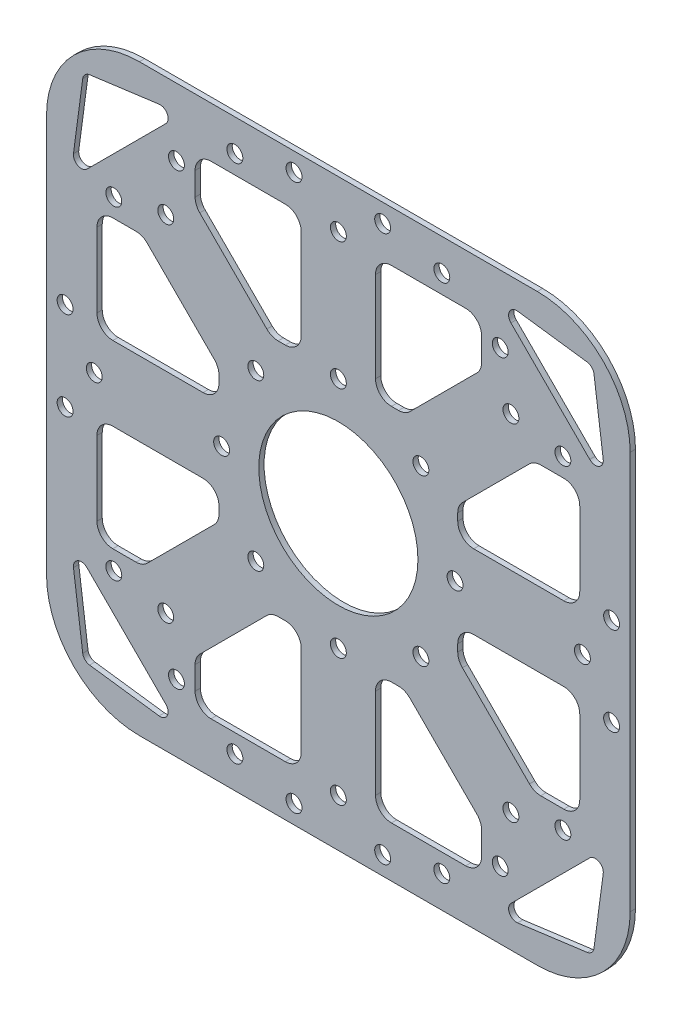
from build123d import *

# Parameters (mm, degrees)
SALIENTE_EXTRUIR1_DEPTH = 1
CROQUIS3_R              = 1.5
CROQUIS3_R_2            = 15
CORTAR_EXTRUIR1_DEPTH   = 1
CORTAR_EXTRUIR2_DEPTH   = 1
CROQUIS5_R              = 1.5
CORTAR_EXTRUIR3_DEPTH   = 1
CORTAR_EXTRUIR4_DEPTH   = 1
CROQUIS8_R              = 1.5
CORTAR_EXTRUIR5_DEPTH   = 1


with BuildPart() as part:
    # Croquis1 → Saliente-Extruir1 (new body)
    with BuildSketch(Plane.XY):
        with BuildLine():
            Line((17.5, 0), (92.5, 0))
            ThreePointArc((92.5, 0), (104.874368671, 5.125631329), (110, 17.5))
            Line((110, 17.5), (110, 92.5))
            ThreePointArc((110, 92.5), (104.874368671, 104.874368671), (92.5, 110))
            Line((92.5, 110), (17.5, 110))
            ThreePointArc((17.5, 110), (5.125631329, 104.874368671), (0, 92.5))
            Line((0, 92.5), (0, 17.5))
            ThreePointArc((0, 17.5), (5.125631329, 5.125631329), (17.5, 0))
        make_face()
    extrude(amount=-SALIENTE_EXTRUIR1_DEPTH)

    # Croquis3 → Cortar-Extruir1 (cut)
    with BuildSketch(Plane.XY):
        with Locations((77, 55)):
            Circle(CROQUIS3_R)
        with Locations((55, 55)):
            Circle(CROQUIS3_R_2)
        with Locations((70.556349186, 70.556349186)):
            Circle(CROQUIS3_R)
        with Locations((87.526911935, 87.526911935)):
            Circle(CROQUIS3_R)
        with Locations((101, 55)):
            Circle(CROQUIS3_R)
        with Locations((70.556349186, 39.443650814)):
            Circle(CROQUIS3_R)
        with Locations((87.526911935, 22.473088065)):
            Circle(CROQUIS3_R)
        with Locations((55, 33)):
            Circle(CROQUIS3_R)
        with Locations((55, 9)):
            Circle(CROQUIS3_R)
        with Locations((39.443650814, 39.443650814)):
            Circle(CROQUIS3_R)
        with Locations((22.473088065, 22.473088065)):
            Circle(CROQUIS3_R)
        with Locations((33, 55)):
            Circle(CROQUIS3_R)
        with Locations((9, 55)):
            Circle(CROQUIS3_R)
        with Locations((39.443650814, 70.556349186)):
            Circle(CROQUIS3_R)
        with Locations((22.473088065, 87.526911935)):
            Circle(CROQUIS3_R)
        with Locations((55, 77)):
            Circle(CROQUIS3_R)
        with Locations((55, 101)):
            Circle(CROQUIS3_R)
    extrude(amount=-CORTAR_EXTRUIR1_DEPTH, mode=Mode.SUBTRACT)

    # Croquis4 → Cortar-Extruir2 (cut)
    with BuildSketch(Plane.XY):
        with BuildLine():
            Line((62, 97.5), (62, 80.5))
            ThreePointArc((62, 80.5), (62.878679656, 78.378679656), (65, 77.5))
            Line((65, 77.5), (66.357864376, 77.5))
            ThreePointArc((66.357864376, 77.5), (67.505914673, 77.728361402), (68.47918472, 78.378679656))
            Line((68.47918472, 78.378679656), (81.121320344, 91.02081528))
            ThreePointArc((81.121320344, 91.02081528), (81.771638598, 91.994085327), (82, 93.142135624))
            Line((82, 93.142135624), (82, 97.5))
            ThreePointArc((82, 97.5), (81.121320344, 99.621320344), (79, 100.5))
            Line((79, 100.5), (65, 100.5))
            ThreePointArc((65, 100.5), (62.878679656, 99.621320344), (62, 97.5))
        make_face()
        with BuildLine():
            Line((77.5, 65), (77.5, 66.357864376))
            ThreePointArc((77.5, 66.357864376), (77.728361402, 67.505914673), (78.378679656, 68.47918472))
            Line((78.378679656, 68.47918472), (91.02081528, 81.121320344))
            ThreePointArc((91.02081528, 81.121320344), (91.994085327, 81.771638598), (93.142135624, 82))
            Line((93.142135624, 82), (97.5, 82))
            ThreePointArc((97.5, 82), (99.621320344, 81.121320344), (100.5, 79))
            Line((100.5, 79), (100.5, 65))
            ThreePointArc((100.5, 65), (99.621320344, 62.878679656), (97.5, 62))
            Line((97.5, 62), (80.5, 62))
            ThreePointArc((80.5, 62), (78.378679656, 62.878679656), (77.5, 65))
        make_face()
        with BuildLine():
            Line((78.378679656, 41.52081528), (91.02081528, 28.878679656))
            ThreePointArc((91.02081528, 28.878679656), (91.994085327, 28.228361402), (93.142135624, 28))
            Line((93.142135624, 28), (97.5, 28))
            ThreePointArc((97.5, 28), (99.621320344, 28.878679656), (100.5, 31))
            Line((100.5, 31), (100.5, 45))
            ThreePointArc((100.5, 45), (99.621320344, 47.121320344), (97.5, 48))
            Line((97.5, 48), (80.5, 48))
            ThreePointArc((80.5, 48), (78.378679656, 47.121320344), (77.5, 45))
            Line((77.5, 45), (77.5, 43.642135624))
            ThreePointArc((77.5, 43.642135624), (77.728361402, 42.494085327), (78.378679656, 41.52081528))
        make_face()
        with BuildLine():
            Line((65, 32.5), (66.357864376, 32.5))
            ThreePointArc((66.357864376, 32.5), (67.505914673, 32.271638598), (68.47918472, 31.621320344))
            Line((68.47918472, 31.621320344), (81.121320344, 18.97918472))
            ThreePointArc((81.121320344, 18.97918472), (81.771638598, 18.005914673), (82, 16.857864376))
            Line((82, 16.857864376), (82, 12.5))
            ThreePointArc((82, 12.5), (81.121320344, 10.378679656), (79, 9.5))
            Line((79, 9.5), (65, 9.5))
            ThreePointArc((65, 9.5), (62.878679656, 10.378679656), (62, 12.5))
            Line((62, 12.5), (62, 29.5))
            ThreePointArc((62, 29.5), (62.878679656, 31.621320344), (65, 32.5))
        make_face()
        with BuildLine():
            Line((41.52081528, 31.621320344), (28.878679656, 18.97918472))
            ThreePointArc((28.878679656, 18.97918472), (28.228361402, 18.005914673), (28, 16.857864376))
            Line((28, 16.857864376), (28, 12.5))
            ThreePointArc((28, 12.5), (28.878679656, 10.378679656), (31, 9.5))
            Line((31, 9.5), (45, 9.5))
            ThreePointArc((45, 9.5), (47.121320344, 10.378679656), (48, 12.5))
            Line((48, 12.5), (48, 29.5))
            ThreePointArc((48, 29.5), (47.121320344, 31.621320344), (45, 32.5))
            Line((45, 32.5), (43.642135624, 32.5))
            ThreePointArc((43.642135624, 32.5), (42.494085327, 32.271638598), (41.52081528, 31.621320344))
        make_face()
        with BuildLine():
            Line((32.5, 45), (32.5, 43.642135624))
            ThreePointArc((32.5, 43.642135624), (32.271638598, 42.494085327), (31.621320344, 41.52081528))
            Line((31.621320344, 41.52081528), (18.97918472, 28.878679656))
            ThreePointArc((18.97918472, 28.878679656), (18.005914673, 28.228361402), (16.857864376, 28))
            Line((16.857864376, 28), (12.5, 28))
            ThreePointArc((12.5, 28), (10.378679656, 28.878679656), (9.5, 31))
            Line((9.5, 31), (9.5, 45))
            ThreePointArc((9.5, 45), (10.378679656, 47.121320344), (12.5, 48))
            Line((12.5, 48), (29.5, 48))
            ThreePointArc((29.5, 48), (31.621320344, 47.121320344), (32.5, 45))
        make_face()
        with BuildLine():
            Line((31.621320344, 68.47918472), (18.97918472, 81.121320344))
            ThreePointArc((18.97918472, 81.121320344), (18.005914673, 81.771638598), (16.857864376, 82))
            Line((16.857864376, 82), (12.5, 82))
            ThreePointArc((12.5, 82), (10.378679656, 81.121320344), (9.5, 79))
            Line((9.5, 79), (9.5, 65))
            ThreePointArc((9.5, 65), (10.378679656, 62.878679656), (12.5, 62))
            Line((12.5, 62), (29.5, 62))
            ThreePointArc((29.5, 62), (31.621320344, 62.878679656), (32.5, 65))
            Line((32.5, 65), (32.5, 66.357864376))
            ThreePointArc((32.5, 66.357864376), (32.271638598, 67.505914673), (31.621320344, 68.47918472))
        make_face()
        with BuildLine():
            Line((45, 77.5), (43.642135624, 77.5))
            ThreePointArc((43.642135624, 77.5), (42.494085327, 77.728361402), (41.52081528, 78.378679656))
            Line((41.52081528, 78.378679656), (28.878679656, 91.02081528))
            ThreePointArc((28.878679656, 91.02081528), (28.228361402, 91.994085327), (28, 93.142135624))
            Line((28, 93.142135624), (28, 97.5))
            ThreePointArc((28, 97.5), (28.878679656, 99.621320344), (31, 100.5))
            Line((31, 100.5), (45, 100.5))
            ThreePointArc((45, 100.5), (47.121320344, 99.621320344), (48, 97.5))
            Line((48, 97.5), (48, 80.5))
            ThreePointArc((48, 80.5), (47.121320344, 78.378679656), (45, 77.5))
        make_face()
    extrude(amount=-CORTAR_EXTRUIR2_DEPTH, mode=Mode.SUBTRACT)

    # Croquis5 → Cortar-Extruir3 (cut)
    with BuildSketch(Plane.XY):
        with Locations((63.351646544, 106.5)):
            Circle(CROQUIS5_R)
        with Locations(Location((46.648353456, 106.5, 0), (0, 0, 180))):
            Circle(CROQUIS5_R)
        with Locations(Location((85.510493326, 97.321505137, 0), (0, 0, 180))):
            Circle(CROQUIS5_R)
        with Locations((97.321505137, 85.510493326)):
            Circle(CROQUIS5_R)
        with Locations(Location((106.5, 63.351646544, 0), (0, 0, 180))):
            Circle(CROQUIS5_R)
        with Locations((106.5, 46.648353456)):
            Circle(CROQUIS5_R)
        with Locations(Location((97.321505137, 24.489506674, 0), (0, 0, 180))):
            Circle(CROQUIS5_R)
        with Locations((85.510493326, 12.678494863)):
            Circle(CROQUIS5_R)
        with Locations(Location((63.351646544, 3.5, 0), (0, 0, 180))):
            Circle(CROQUIS5_R)
        with Locations((46.648353456, 3.5)):
            Circle(CROQUIS5_R)
        with Locations(Location((24.489506674, 12.678494863, 0), (0, 0, 180))):
            Circle(CROQUIS5_R)
        with Locations((12.678494863, 24.489506674)):
            Circle(CROQUIS5_R)
        with Locations(Location((3.5, 46.648353456, 0), (0, 0, 180))):
            Circle(CROQUIS5_R)
        with Locations((3.5, 63.351646544)):
            Circle(CROQUIS5_R)
        with Locations(Location((12.678494863, 85.510493326, 0), (0, 0, 180))):
            Circle(CROQUIS5_R)
        with Locations((24.489506674, 97.321505137)):
            Circle(CROQUIS5_R)
    extrude(amount=-CORTAR_EXTRUIR3_DEPTH, mode=Mode.SUBTRACT)

    # Croquis7 → Cortar-Extruir4 (cut)
    with BuildSketch(Plane.XY):
        with BuildLine():
            Line((87.526911935, 102.376154339), (102.376154339, 87.526911935))
            ThreePointArc((102.376154339, 87.526911935), (104.10121312, 87.242739593), (104.923699172, 88.785496349))
            Line((104.923699172, 88.785496349), (103.179272816, 101.890312398))
            ThreePointArc((103.179272816, 101.890312398), (102.753048327, 102.753048327), (101.890312398, 103.179272816))
            Line((101.890312398, 103.179272816), (88.785496349, 104.923699172))
            ThreePointArc((88.785496349, 104.923699172), (87.242739593, 104.10121312), (87.526911935, 102.376154339))
        make_face()
        with BuildLine():
            Line((102.376154339, 22.473088065), (87.526911935, 7.623845661))
            ThreePointArc((87.526911935, 7.623845661), (87.242739593, 5.89878688), (88.785496349, 5.076300828))
            Line((88.785496349, 5.076300828), (101.890312398, 6.820727184))
            ThreePointArc((101.890312398, 6.820727184), (102.753048327, 7.246951673), (103.179272816, 8.109687602))
            Line((103.179272816, 8.109687602), (104.923699172, 21.214503651))
            ThreePointArc((104.923699172, 21.214503651), (104.10121312, 22.757260407), (102.376154339, 22.473088065))
        make_face()
        with BuildLine():
            Line((22.473088065, 7.623845661), (7.623845661, 22.473088065))
            ThreePointArc((7.623845661, 22.473088065), (5.89878688, 22.757260407), (5.076300828, 21.214503651))
            Line((5.076300828, 21.214503651), (6.820727184, 8.109687602))
            ThreePointArc((6.820727184, 8.109687602), (7.246951673, 7.246951673), (8.109687602, 6.820727184))
            Line((8.109687602, 6.820727184), (21.214503651, 5.076300828))
            ThreePointArc((21.214503651, 5.076300828), (22.757260407, 5.89878688), (22.473088065, 7.623845661))
        make_face()
        with BuildLine():
            Line((7.623845661, 87.526911935), (22.473088065, 102.376154339))
            ThreePointArc((22.473088065, 102.376154339), (22.757260407, 104.10121312), (21.214503651, 104.923699172))
            Line((21.214503651, 104.923699172), (8.109687602, 103.179272816))
            ThreePointArc((8.109687602, 103.179272816), (7.246951673, 102.753048327), (6.820727184, 101.890312398))
            Line((6.820727184, 101.890312398), (5.076300828, 88.785496349))
            ThreePointArc((5.076300828, 88.785496349), (5.89878688, 87.242739593), (7.623845661, 87.526911935))
        make_face()
    extrude(amount=-CORTAR_EXTRUIR4_DEPTH, mode=Mode.SUBTRACT)

    # Croquis8 → Cortar-Extruir5 (cut)
    with BuildSketch(Plane.XY):
        with Locations((74.5, 104)):
            Circle(CROQUIS8_R)
        with Locations(Location((35.5, 104, 0), (0, 0, 180))):
            Circle(CROQUIS8_R)
        with Locations((35.5, 6)):
            Circle(CROQUIS8_R)
        with Locations(Location((74.5, 6, 0), (0, 0, 180))):
            Circle(CROQUIS8_R)
    extrude(amount=-CORTAR_EXTRUIR5_DEPTH, mode=Mode.SUBTRACT)


solid = part.part
